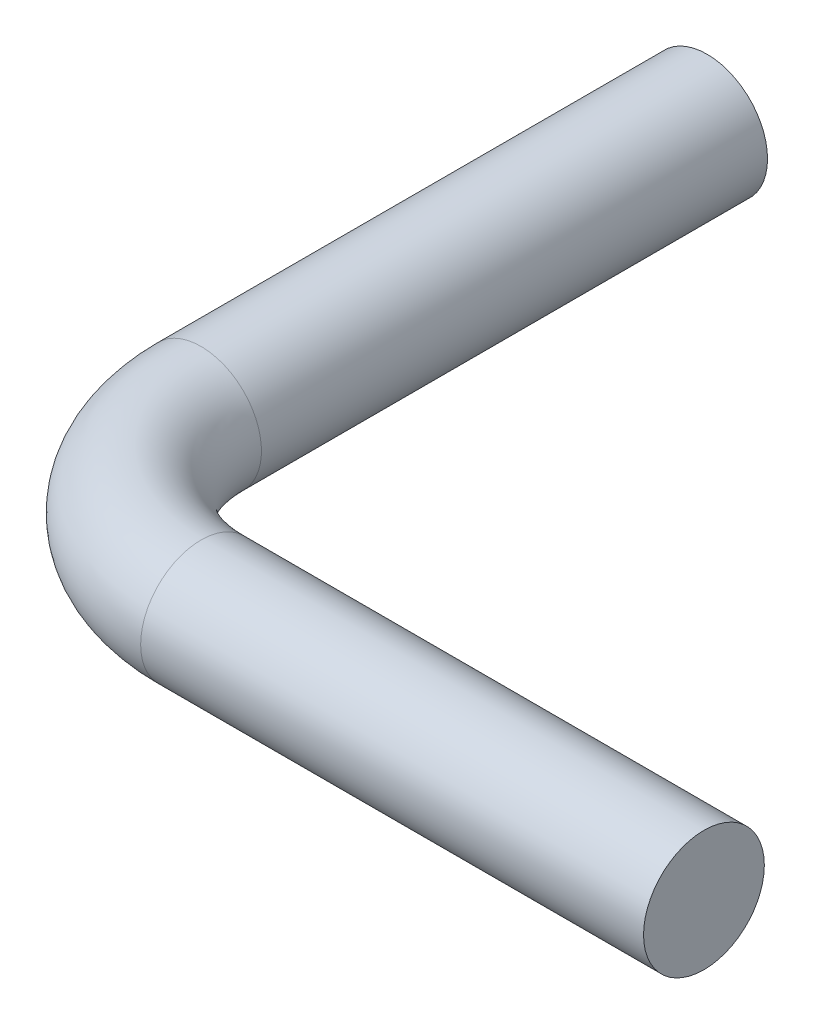
from build123d import *

# Parameters (mm, degrees)
CROQUIS2_R = 1.801365654


with BuildPart() as part:
    # Barrer1: sweep along a path in Croquis34
    with BuildLine(Plane(origin=(0, 0, 0), x_dir=(1, 0, 0), z_dir=(0, 1, 0))) as barrer1_path:
        Line((0, 0), (-15, 0))
        ThreePointArc((-15, 0), (-18.535533906, 1.464466094), (-20, 5))
        Line((-20, 5), (-20, 20.095189644))
    # Croquis2 → Barrer1 (sweep)
    with BuildSketch(Plane(origin=(0, 0, 0), x_dir=(0, 0, -1), z_dir=(1, 0, 0))):
        Circle(CROQUIS2_R)
    sweep(path=barrer1_path.line)


solid = part.part
